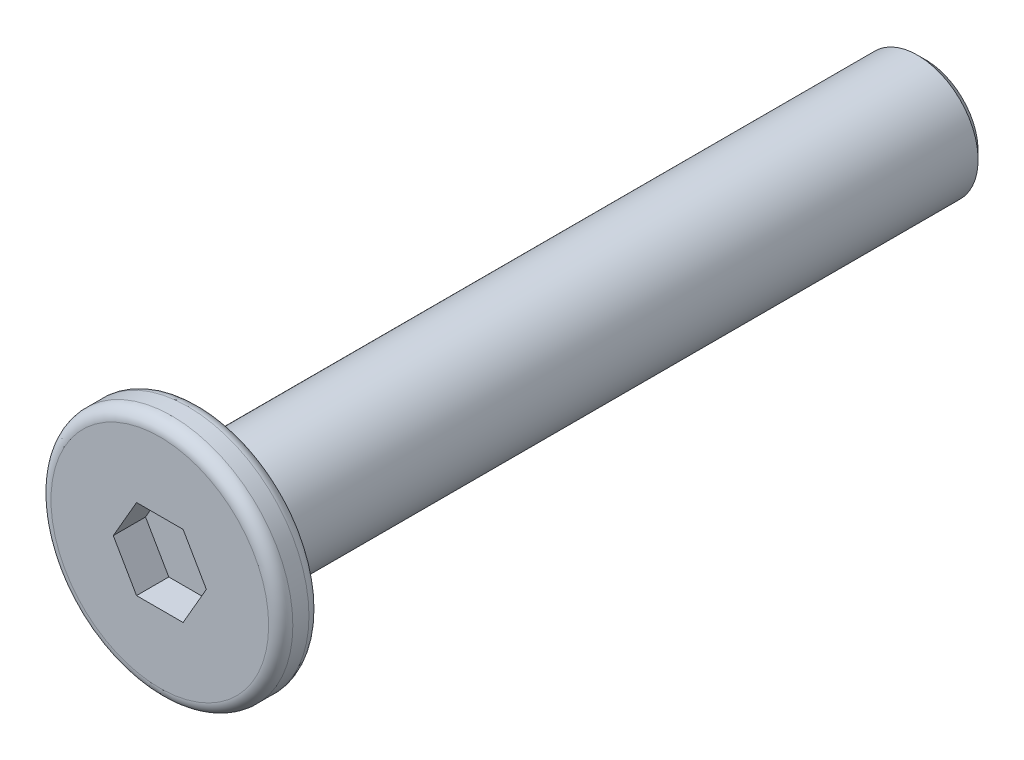
from build123d import *

# Parameters (mm, degrees)
SKETCH_1_R          = 3
EXTRUDE_1_DEPTH     = 0.5
SKETCH_2_R          = 1.5
EXTRUDE_2_DEPTH     = 18
CHAMFER_1_SIZE      = 0.2
CUT_EXTRUDE_1_DEPTH = 0.8
FILLET_2_R          = 0.3


with BuildPart() as part:
    # 草图1 → 凸台-拉伸1 (new, symmetric)
    with BuildSketch(Plane.XY):
        Circle(SKETCH_1_R)
    extrude(amount=EXTRUDE_1_DEPTH, both=True)

    # 草图2 → 凸台-拉伸2 (add)
    with BuildSketch(Plane(origin=(0, 0, -0.5), x_dir=(-1, 0, 0), z_dir=(0, 0, -1))):
        Circle(SKETCH_2_R)
    extrude(amount=EXTRUDE_2_DEPTH)

    # 倒角1
    chamfer_1_edges = [part.edges().sort_by_distance(p)[0] for p in [
        (1.5, 0, -18.5),
    ]]
    chamfer(chamfer_1_edges, length=CHAMFER_1_SIZE)

    # 草图3 → 切除-拉伸1 (cut)
    with BuildSketch(Plane.XY.offset(0.5)):
        Polygon((1.154700538, 0), (0.577350269, 1), (-0.577350269, 1), (-1.154700538, 0), (-0.577350269, -1), (0.577350269, -1), align=None)
    extrude(amount=-CUT_EXTRUDE_1_DEPTH, mode=Mode.SUBTRACT)

    # 圆角2
    fillet_2_edges = [part.edges().sort_by_distance(p)[0] for p in [
        (-3, 0, -0.5),
        (-3, 0, 0.5),
    ]]
    fillet(fillet_2_edges, radius=FILLET_2_R)


solid = part.part
